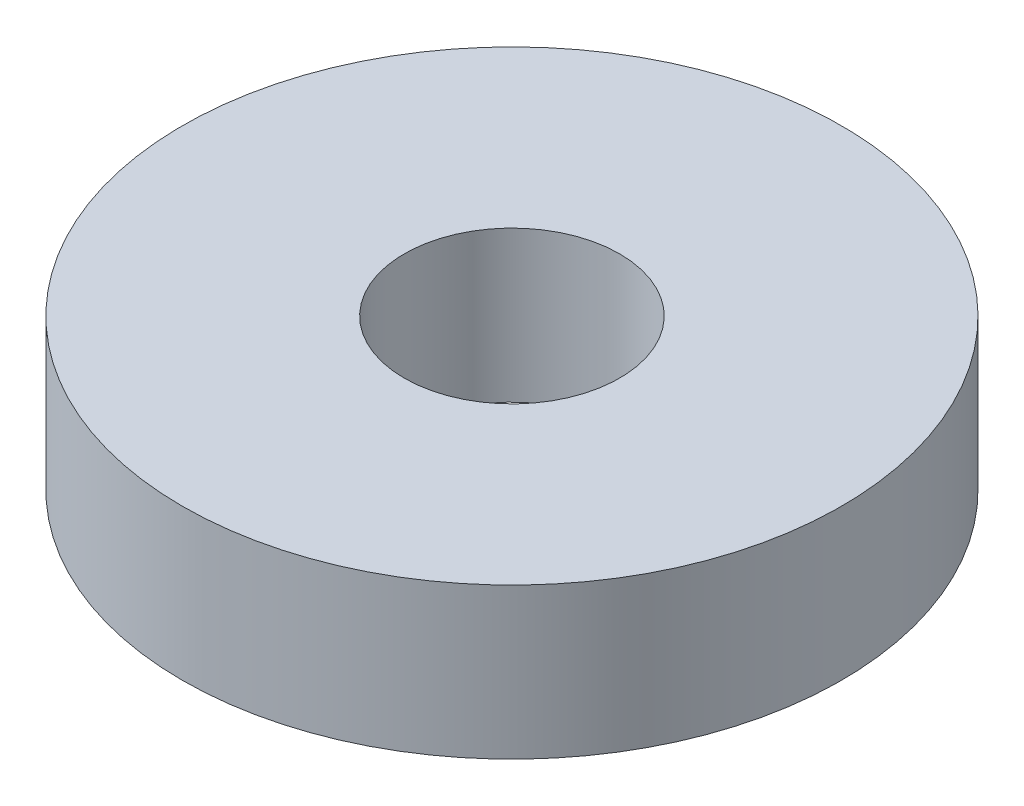
from build123d import *

# Parameters (mm, degrees)
SKETCH1_R           = 7.65
SKETCH1_R_2         = 2.5
BOSS_EXTRUDE1_DEPTH = 3.5


with BuildPart() as part:
    # Sketch1 → Boss-Extrude1 (new body)
    with BuildSketch(Plane(origin=(0, 0, 0), x_dir=(1, 0, 0), z_dir=(0, 1, 0))):
        with Locations(Location((0, 0, 0), (0, 0, 270))):
            Circle(SKETCH1_R)
        with Locations(Location((0, 0, 0), (0, 0, 270))):
            Circle(SKETCH1_R_2, mode=Mode.SUBTRACT)
    extrude(amount=BOSS_EXTRUDE1_DEPTH)


solid = part.part
